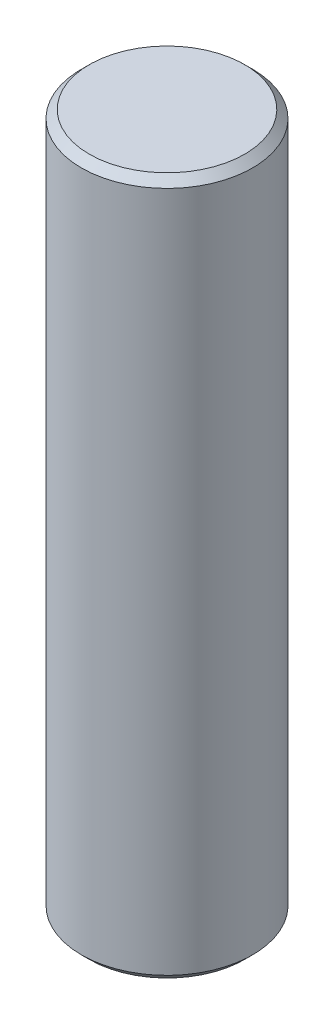
from build123d import *

# Parameters (mm, degrees)
SKETCH1_R           = 2.7
BOSS_EXTRUDE1_DEPTH = 22
CHAMFER1_SIZE       = 0.25


with BuildPart() as part:
    # Sketch1 → Boss-Extrude1 (new body)
    with BuildSketch(Plane(origin=(0, 0, 0), x_dir=(1, 0, 0), z_dir=(0, 1, 0))):
        with Locations(Location((0, 0, 0), (0, 0, 270))):
            Circle(SKETCH1_R)
    extrude(amount=BOSS_EXTRUDE1_DEPTH)

    # Chamfer1
    chamfer1_edges = [part.edges().sort_by_distance(p)[0] for p in [
        (0, 0, -2.7),
        (0, 22, -2.7),
    ]]
    chamfer(chamfer1_edges, length=CHAMFER1_SIZE)


solid = part.part
